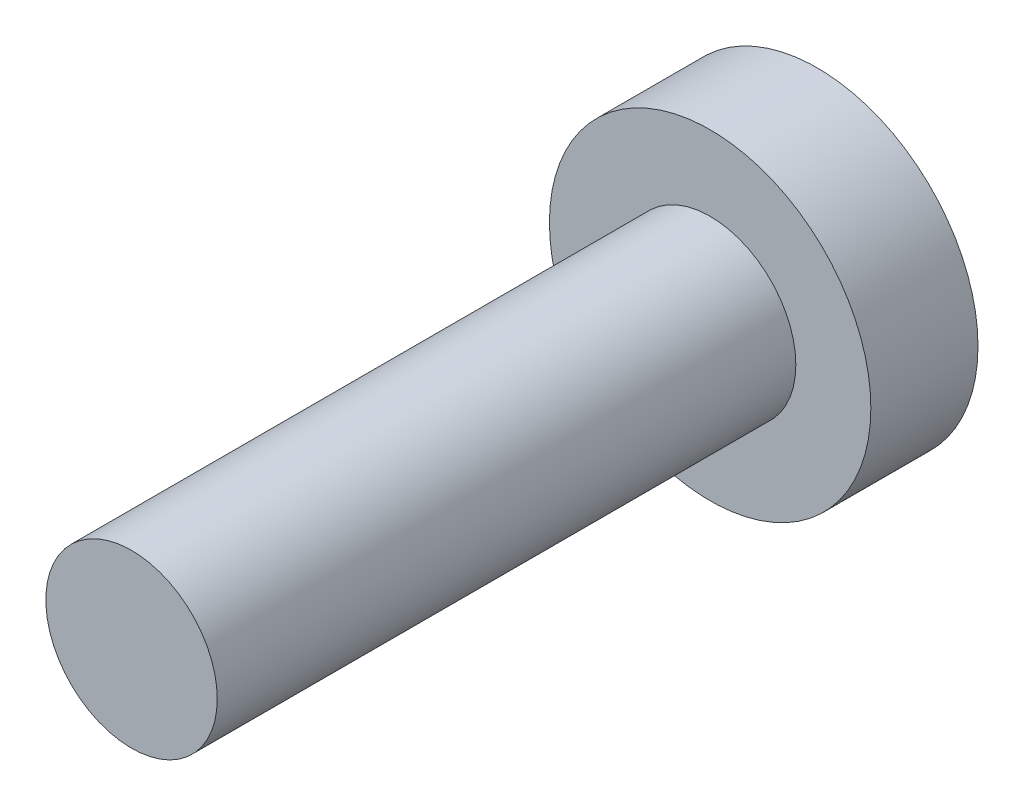
from build123d import *

# Parameters (mm, degrees)
SK_CABEZA_AVELLANADA_R  = 3.75
CABEZA_AVELLANADA_DEPTH = 2.5
SK_CUERPO_R             = 2
CUERPO_DEPTH            = 16
HEXAGONO_INTERIOR_DEPTH = 1.5


with BuildPart() as part:
    # Sk_Cabeza_avellanada → Cabeza_avellanada (new body)
    with BuildSketch(Plane.XY):
        Circle(SK_CABEZA_AVELLANADA_R)
    extrude(amount=CABEZA_AVELLANADA_DEPTH)

    # Sk_Cuerpo → Cuerpo (add)
    with BuildSketch(Plane.XY):
        Circle(SK_CUERPO_R)
    extrude(amount=CUERPO_DEPTH)

    # Sk_Hexagono_interior → Hexagono_interior (cut)
    with BuildSketch(Plane.XY):
        Polygon((0, -1.443375673), (1.25, -0.721687836), (1.25, 0.721687836), (0, 1.443375673), (-1.25, 0.721687836), (-1.25, -0.721687836), align=None)
    extrude(amount=HEXAGONO_INTERIOR_DEPTH, mode=Mode.SUBTRACT)


solid = part.part
